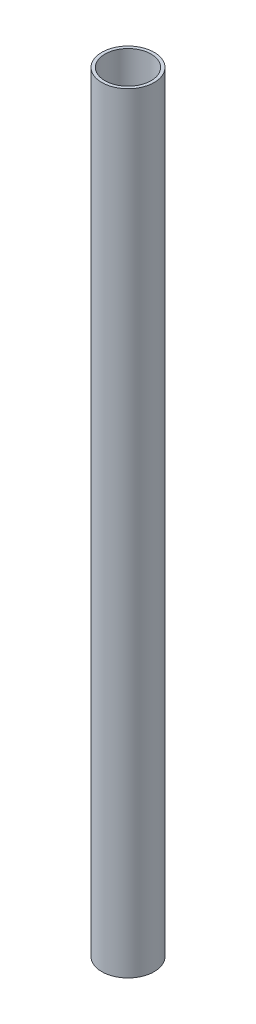
from build123d import *

# Parameters (mm, degrees)
SKETCH1_R           = 17
SKETCH1_R_2         = 15
BOSS_EXTRUDE1_DEPTH = 500


with BuildPart() as part:
    # Sketch1 → Boss-Extrude1 (new body)
    with BuildSketch(Plane(origin=(0, 0, 0), x_dir=(1, 0, 0), z_dir=(0, 1, 0))):
        with Locations(Location((0, 0, 0), (0, 0, 270))):
            Circle(SKETCH1_R)
        with Locations(Location((0, 0, 0), (0, 0, 270))):
            Circle(SKETCH1_R_2, mode=Mode.SUBTRACT)
    extrude(amount=BOSS_EXTRUDE1_DEPTH)


solid = part.part
